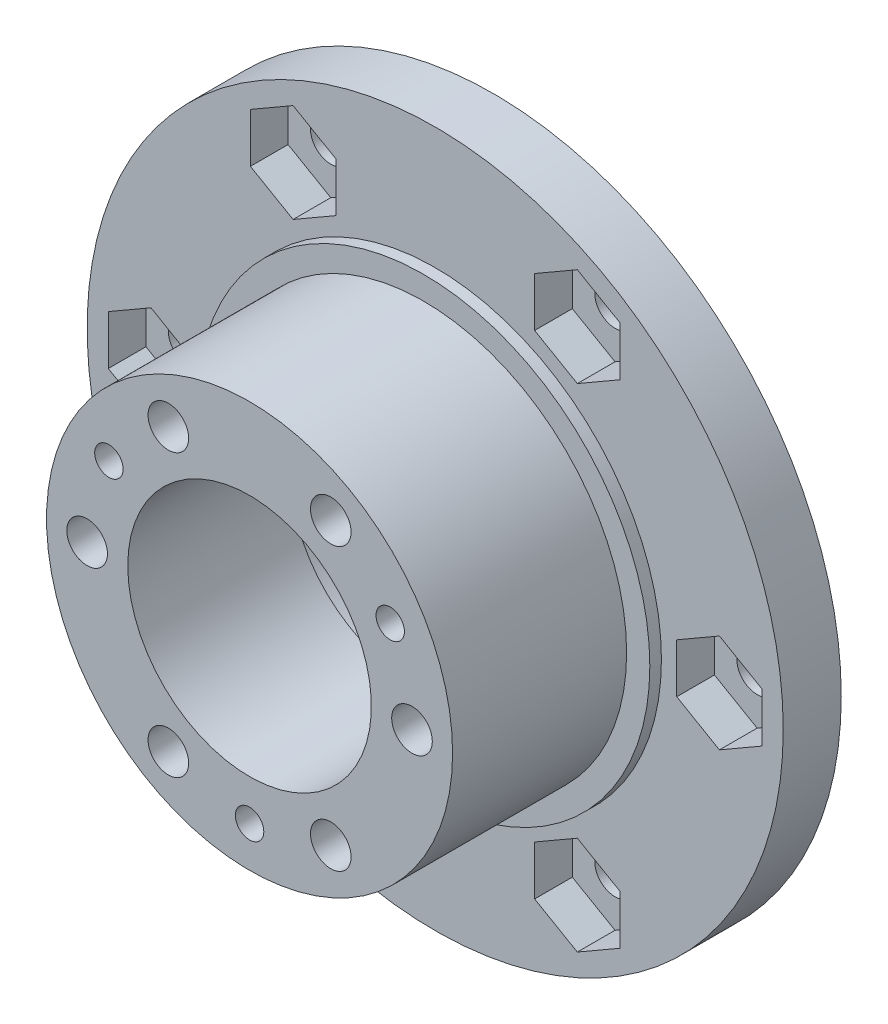
from build123d import *

# Parameters (mm, degrees)
SKETCH1_R           = 30
BOSS_EXTRUDE1_DEPTH = 5
SKETCH2_R           = 19.5
BOSS_EXTRUDE2_DEPTH = 1
SKETCH3_R           = 17.5
BOSS_EXTRUDE3_DEPTH = 15
SKETCH4_R           = 12.025
CUT_EXTRUDE1_DEPTH  = 7
SKETCH5_R           = 10.5
CUT_EXTRUDE2_DEPTH  = 45.676615807
SKETCH6_R           = 1.75
CUT_EXTRUDE3_DEPTH  = 46.343136195
SKETCH7_R           = 1.75
CUT_EXTRUDE4_DEPTH  = 10
SKETCH8_R           = 1.225
CUT_EXTRUDE5_DEPTH  = 12
CUT_EXTRUDE6_DEPTH  = 3.25


with BuildPart() as part:
    # Sketch1 → Boss-Extrude1 (new body)
    with BuildSketch(Plane.XY):
        Circle(SKETCH1_R)
    extrude(amount=BOSS_EXTRUDE1_DEPTH)

    # Sketch2 → Boss-Extrude2 (add)
    with BuildSketch(Plane.XY.offset(5)):
        Circle(SKETCH2_R)
    extrude(amount=BOSS_EXTRUDE2_DEPTH)

    # Sketch3 → Boss-Extrude3 (add)
    with BuildSketch(Plane.XY.offset(6)):
        Circle(SKETCH3_R)
    extrude(amount=BOSS_EXTRUDE3_DEPTH)

    # Sketch4 → Cut-Extrude1 (cut)
    with BuildSketch(Plane(origin=(0, 0, 0), x_dir=(-1, 0, 0), z_dir=(0, 0, -1))):
        Circle(SKETCH4_R)
    extrude(amount=-CUT_EXTRUDE1_DEPTH, mode=Mode.SUBTRACT)

    # Sketch5 → Cut-Extrude2 (cut, through all)
    with BuildSketch(Plane(origin=(0, 0, 7), x_dir=(-1, 0, 0), z_dir=(0, 0, -1))):
        Circle(SKETCH5_R)
    extrude(amount=-CUT_EXTRUDE2_DEPTH, mode=Mode.SUBTRACT)

    # Sketch6 → Cut-Extrude3 (cut, through all)
    with BuildSketch(Plane.XY.offset(5)):
        with Locations((24.5, 0)):
            Circle(SKETCH6_R)
        with Locations((12.25, -21.217622393)):
            Circle(SKETCH6_R)
        with Locations((-12.25, -21.217622393)):
            Circle(SKETCH6_R)
        with Locations((-24.5, 0)):
            Circle(SKETCH6_R)
        with Locations((-12.25, 21.217622393)):
            Circle(SKETCH6_R)
        with Locations((12.25, 21.217622393)):
            Circle(SKETCH6_R)
    extrude(amount=-CUT_EXTRUDE3_DEPTH, mode=Mode.SUBTRACT)

    # Sketch7 → Cut-Extrude4 (cut)
    with BuildSketch(Plane.XY.offset(21)):
        with Locations((14, 0)):
            Circle(SKETCH7_R)
        with Locations((7, -12.124355653)):
            Circle(SKETCH7_R)
        with Locations((-7, -12.124355653)):
            Circle(SKETCH7_R)
        with Locations((-14, 0)):
            Circle(SKETCH7_R)
        with Locations((-7, 12.124355653)):
            Circle(SKETCH7_R)
        with Locations((7, 12.124355653)):
            Circle(SKETCH7_R)
    extrude(amount=-CUT_EXTRUDE4_DEPTH, mode=Mode.SUBTRACT)

    # Sketch8 → Cut-Extrude5 (cut)
    with BuildSketch(Plane.XY.offset(21)):
        with Locations((12.124355653, 7)):
            Circle(SKETCH8_R)
        with Locations((0, -14)):
            Circle(SKETCH8_R)
        with Locations((-12.124355653, 7)):
            Circle(SKETCH8_R)
    extrude(amount=-CUT_EXTRUDE5_DEPTH, mode=Mode.SUBTRACT)

    # Sketch9 → Cut-Extrude6 (cut)
    with BuildSketch(Plane.XY.offset(5)):
        Polygon((12.25, -16.967622393), (8.569392034, -19.092622393), (8.569392034, -23.342622393), (12.25, -25.467622393), (15.930607966, -23.342622393), (15.930607966, -19.092622393), align=None)
        Polygon((24.5, 4.25), (20.819392034, 2.125), (20.819392034, -2.125), (24.5, -4.25), (28.180607966, -2.125), (28.180607966, 2.125), align=None)
        Polygon((-8.569392034, -19.092622393), (-12.25, -16.967622393), (-15.930607966, -19.092622393), (-15.930607966, -23.342622393), (-12.25, -25.467622393), (-8.569392034, -23.342622393), align=None)
        Polygon((-20.819392034, -2.125), (-20.819392034, 2.125), (-24.5, 4.25), (-28.180607966, 2.125), (-28.180607966, -2.125), (-24.5, -4.25), align=None)
        Polygon((-12.25, 16.967622393), (-8.569392034, 19.092622393), (-8.569392034, 23.342622393), (-12.25, 25.467622393), (-15.930607966, 23.342622393), (-15.930607966, 19.092622393), align=None)
        Polygon((8.569392034, 19.092622393), (12.25, 16.967622393), (15.930607966, 19.092622393), (15.930607966, 23.342622393), (12.25, 25.467622393), (8.569392034, 23.342622393), align=None)
    extrude(amount=-CUT_EXTRUDE6_DEPTH, mode=Mode.SUBTRACT)


solid = part.part
